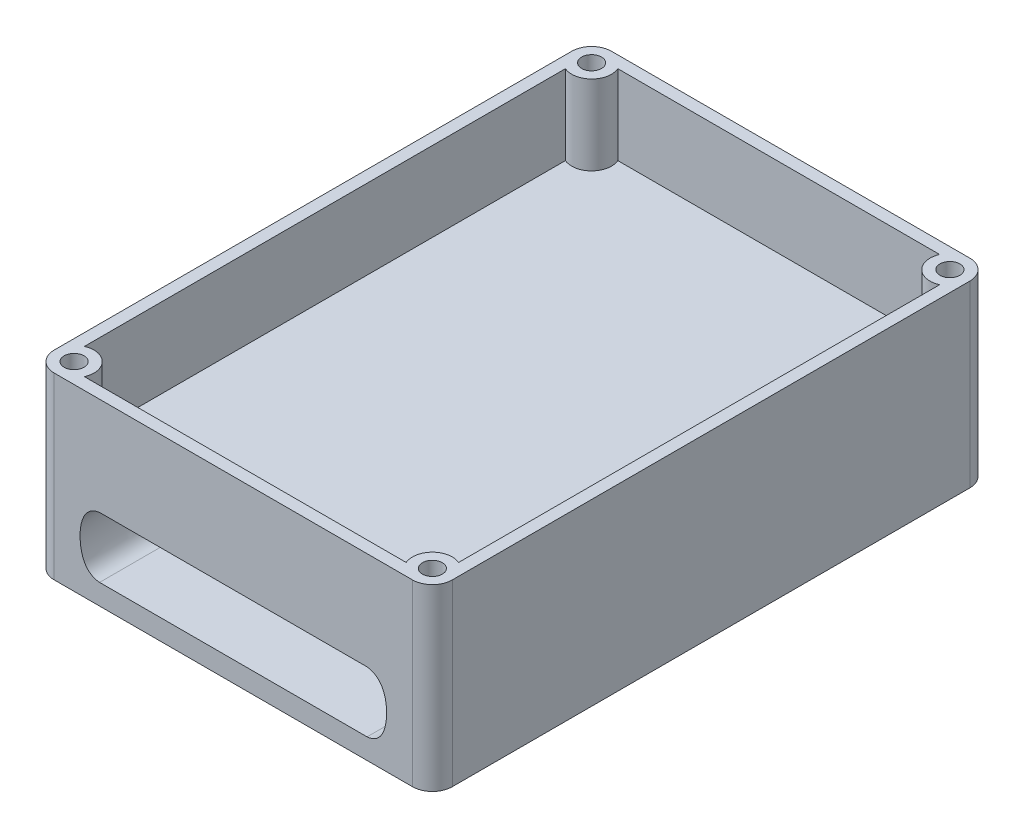
from build123d import *

# Parameters (mm, degrees)
BOSS_EXTRUDE2_DEPTH = 25
BOSS_EXTRUDE3_START = 25
SKETCH1_3_R         = 2.5
BOSS_EXTRUDE3_DEPTH = 20
CUT_EXTRUDE1_DEPTH  = 130


with BuildPart() as part:
    # Sketch1 → Boss-Extrude2 (new body)
    with BuildSketch(Plane(origin=(0, 0, 0), x_dir=(1, 0, 0), z_dir=(0, 1, 0))):
        with BuildLine():
            Line((-45, 70), (45, 70))
            ThreePointArc((45, 70), (48.535533906, 68.535533906), (50, 65))
            Line((50, 65), (50, -65))
            ThreePointArc((50, -65), (48.535533906, -68.535533906), (45, -70))
            Line((45, -70), (-45, -70))
            ThreePointArc((-45, -70), (-48.535533906, -68.535533906), (-50, -65))
            Line((-50, -65), (-50, 65))
            ThreePointArc((-50, 65), (-48.535533906, 68.535533906), (-45, 70))
        make_face()
    extrude(amount=BOSS_EXTRUDE2_DEPTH)

    # Sketch1<3> → Boss-Extrude3 (add)
    with BuildSketch(Plane(origin=(0, 0, 0), x_dir=(1, 0, 0), z_dir=(0, 1, 0)).offset(BOSS_EXTRUDE3_START)):
        with BuildLine():
            Line((-45, 70), (45, 70))
            ThreePointArc((45, 70), (48.535533906, 68.535533906), (50, 65))
            Line((50, 65), (50, -65))
            ThreePointArc((50, -65), (48.535533906, -68.535533906), (45, -70))
            Line((45, -70), (-45, -70))
            ThreePointArc((-45, -70), (-48.535533906, -68.535533906), (-50, -65))
            Line((-50, -65), (-50, 65))
            ThreePointArc((-50, 65), (-48.535533906, 68.535533906), (-45, 70))
        make_face()
        with Locations(Location((-45, 65, 0), (0, 0, 270))):
            Circle(SKETCH1_3_R, mode=Mode.SUBTRACT)
        with Locations(Location((45, 65, 0), (0, 0, 270))):
            Circle(SKETCH1_3_R, mode=Mode.SUBTRACT)
        with Locations(Location((45, -65, 0), (0, 0, 270))):
            Circle(SKETCH1_3_R, mode=Mode.SUBTRACT)
        with Locations(Location((-45, -65, 0), (0, 0, 270))):
            Circle(SKETCH1_3_R, mode=Mode.SUBTRACT)
        with BuildLine():
            Line((-40.417424305, 67), (40.417424305, 67))
            ThreePointArc((40.417424305, 67), (41.464466094, 61.464466094), (47, 60.417424305))
            Line((47, 60.417424305), (47, -60.417424305))
            ThreePointArc((47, -60.417424305), (41.464466094, -61.464466094), (40.417424305, -67))
            Line((40.417424305, -67), (-40.417424305, -67))
            ThreePointArc((-40.417424305, -67), (-41.464466094, -61.464466094), (-47, -60.417424305))
            Line((-47, -60.417424305), (-47, 60.417424305))
            ThreePointArc((-47, 60.417424305), (-41.464466094, 61.464466094), (-40.417424305, 67))
        make_face(mode=Mode.SUBTRACT)
    extrude(amount=BOSS_EXTRUDE3_DEPTH)

    # Sketch2 → Cut-Extrude1 (cut)
    with BuildSketch(Plane.XY.offset(70)):
        with BuildLine():
            Line((-33.600286554, 5.152304199), (33.600286554, 5.152304199))
            add(Edge.make_bspline(
                [(33.600286554, 20.375134216), (37.254581283, 19.906525536), (39.744987875, 13.002442779), (37.255381919, 5.419067927), (33.600286554, 5.152304199)],
                knots=[0, 0, 0, 0, 0.5, 1, 1, 1, 1], degree=3))
            Line((33.600286554, 20.375134216), (-33.600286554, 20.375134216))
            add(Edge.make_bspline(
                [(-33.600286554, 20.375134216), (-37.254581283, 19.906525536), (-39.744987875, 12.865320549), (-37.255381919, 5.419067927), (-33.600286554, 5.152304199)],
                knots=[0, 0, 0, 0, 0.5, 1, 1, 1, 1], degree=3))
        make_face()
    extrude(amount=-CUT_EXTRUDE1_DEPTH, mode=Mode.SUBTRACT)


solid = part.part
